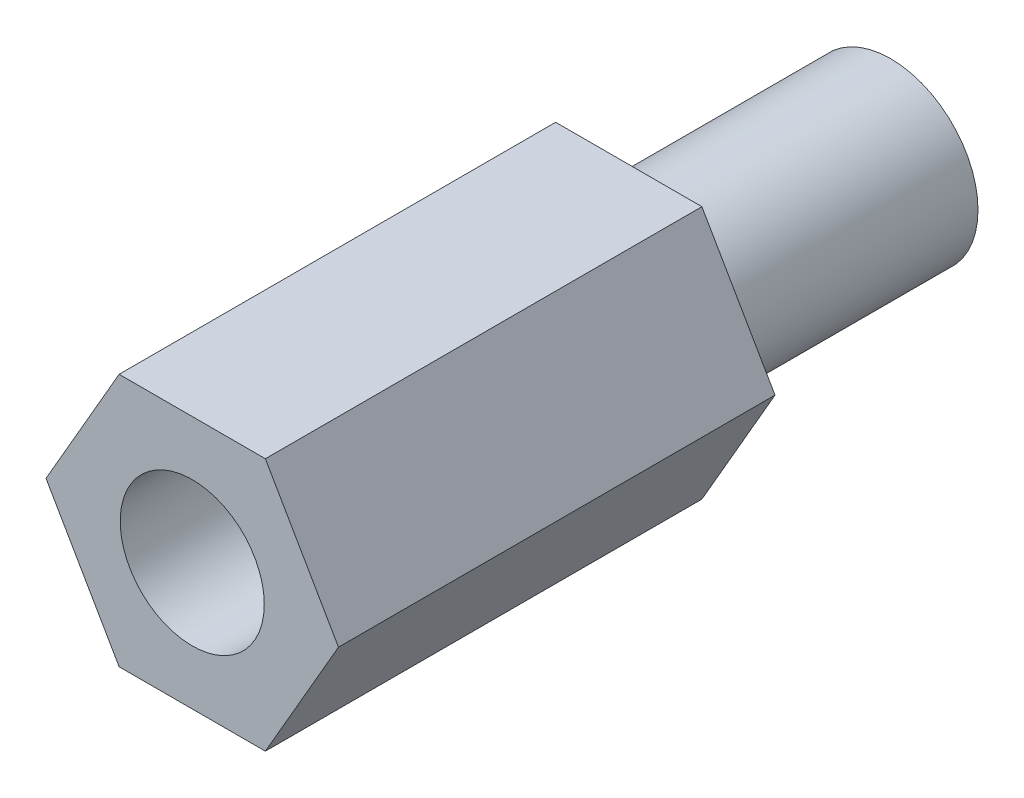
from build123d import *

# Parameters (mm, degrees)
EXTRUDE_1_DEPTH     = 10
SKETCH_2_R          = 2
EXTRUDE_2_DEPTH     = 6
SKETCH_3_R          = 1.65
CUT_EXTRUDE_1_DEPTH = 5


with BuildPart() as part:
    # 草圖1 → 填料-伸長1 (new body)
    with BuildSketch(Plane.XY):
        Polygon((1.675, 2.901185103), (-1.675, 2.901185103), (-3.35, 0), (-1.675, -2.901185103), (1.675, -2.901185103), (3.35, 0), align=None)
    extrude(amount=EXTRUDE_1_DEPTH)

    # 草圖2 → 填料-伸長2 (add)
    with BuildSketch(Plane(origin=(0, 0, 0), x_dir=(-1, 0, 0), z_dir=(0, 0, -1))):
        Circle(SKETCH_2_R)
    extrude(amount=EXTRUDE_2_DEPTH)

    # 草圖3 → 除料-伸長1 (cut)
    with BuildSketch(Plane.XY.offset(10)):
        Circle(SKETCH_3_R)
    extrude(amount=-CUT_EXTRUDE_1_DEPTH, mode=Mode.SUBTRACT)


solid = part.part
